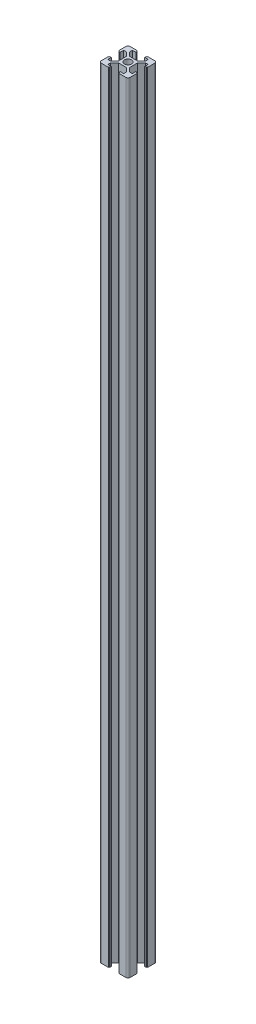
from build123d import *

# Parameters (mm, degrees)
SKETCH_2_R      = 2.5
EXTRUDE_1_DEPTH = 540


with BuildPart() as part:
    # 草图2 → 凸台-拉伸1 (new body)
    with BuildSketch(Plane(origin=(0, 0, 0), x_dir=(1, 0, 0), z_dir=(0, 1, 0))):
        with BuildLine():
            Line((-3.6, 10), (-3.6, 9.5))
            Line((-3.6, 9.5), (-3.1, 9.5))
            Line((-3.1, 9.5), (-3.1, 8.5))
            Line((-3.1, 8.5), (-5.5, 8.5))
            Line((-5.5, 8.5), (-5.5, 6.65))
            Line((-5.5, 6.65), (-2.75, 3.9))
            Line((-2.75, 3.9), (2.75, 3.9))
            Line((2.75, 3.9), (5.5, 6.65))
            Line((5.5, 6.65), (5.5, 8.5))
            Line((5.5, 8.5), (3.1, 8.5))
            Line((3.1, 8.5), (3.1, 9.5))
            Line((3.1, 9.5), (3.6, 9.5))
            Line((3.6, 9.5), (3.6, 10))
            Line((3.6, 10), (8.5, 10))
            ThreePointArc((8.5, 10), (9.560660172, 9.560660172), (10, 8.5))
            Line((10, 8.5), (10, 3.6))
            Line((10, 3.6), (9.5, 3.6))
            Line((9.5, 3.6), (9.5, 3.1))
            Line((9.5, 3.1), (8.5, 3.1))
            Line((8.5, 3.1), (8.5, 5.5))
            Line((8.5, 5.5), (6.65, 5.5))
            Line((6.65, 5.5), (3.9, 2.75))
            Line((3.9, 2.75), (3.9, -2.75))
            Line((3.9, -2.75), (6.65, -5.5))
            Line((6.65, -5.5), (8.5, -5.5))
            Line((8.5, -5.5), (8.5, -3.1))
            Line((8.5, -3.1), (9.5, -3.1))
            Line((9.5, -3.1), (9.5, -3.6))
            Line((9.5, -3.6), (10, -3.6))
            Line((10, -3.6), (10, -8.5))
            ThreePointArc((10, -8.5), (9.560660172, -9.560660172), (8.5, -10))
            Line((8.5, -10), (3.6, -10))
            Line((3.6, -10), (3.6, -9.5))
            Line((3.6, -9.5), (3.1, -9.5))
            Line((3.1, -9.5), (3.1, -8.5))
            Line((3.1, -8.5), (5.5, -8.5))
            Line((5.5, -8.5), (5.5, -6.65))
            Line((5.5, -6.65), (2.75, -3.9))
            Line((2.75, -3.9), (-2.75, -3.9))
            Line((-2.75, -3.9), (-5.5, -6.65))
            Line((-5.5, -6.65), (-5.5, -8.5))
            Line((-5.5, -8.5), (-3.1, -8.5))
            Line((-3.1, -8.5), (-3.1, -9.5))
            Line((-3.1, -9.5), (-3.6, -9.5))
            Line((-3.6, -9.5), (-3.6, -10))
            Line((-3.6, -10), (-8.5, -10))
            ThreePointArc((-8.5, -10), (-9.560660172, -9.560660172), (-10, -8.5))
            Line((-10, -8.5), (-10, -3.6))
            Line((-10, -3.6), (-9.5, -3.6))
            Line((-9.5, -3.6), (-9.5, -3.1))
            Line((-9.5, -3.1), (-8.5, -3.1))
            Line((-8.5, -3.1), (-8.5, -5.5))
            Line((-8.5, -5.5), (-6.65, -5.5))
            Line((-6.65, -5.5), (-3.9, -2.75))
            Line((-3.9, -2.75), (-3.9, 2.75))
            Line((-3.9, 2.75), (-6.65, 5.5))
            Line((-6.65, 5.5), (-8.5, 5.5))
            Line((-8.5, 5.5), (-8.5, 3.1))
            Line((-8.5, 3.1), (-9.5, 3.1))
            Line((-9.5, 3.1), (-9.5, 3.6))
            Line((-9.5, 3.6), (-10, 3.6))
            Line((-10, 3.6), (-10, 8.5))
            ThreePointArc((-10, 8.5), (-9.560660172, 9.560660172), (-8.5, 10))
            Line((-8.5, 10), (-3.6, 10))
        make_face()
        with Locations(Location((0, 0, 0), (0, 0, 270))):
            Circle(SKETCH_2_R, mode=Mode.SUBTRACT)
    extrude(amount=EXTRUDE_1_DEPTH)


solid = part.part
